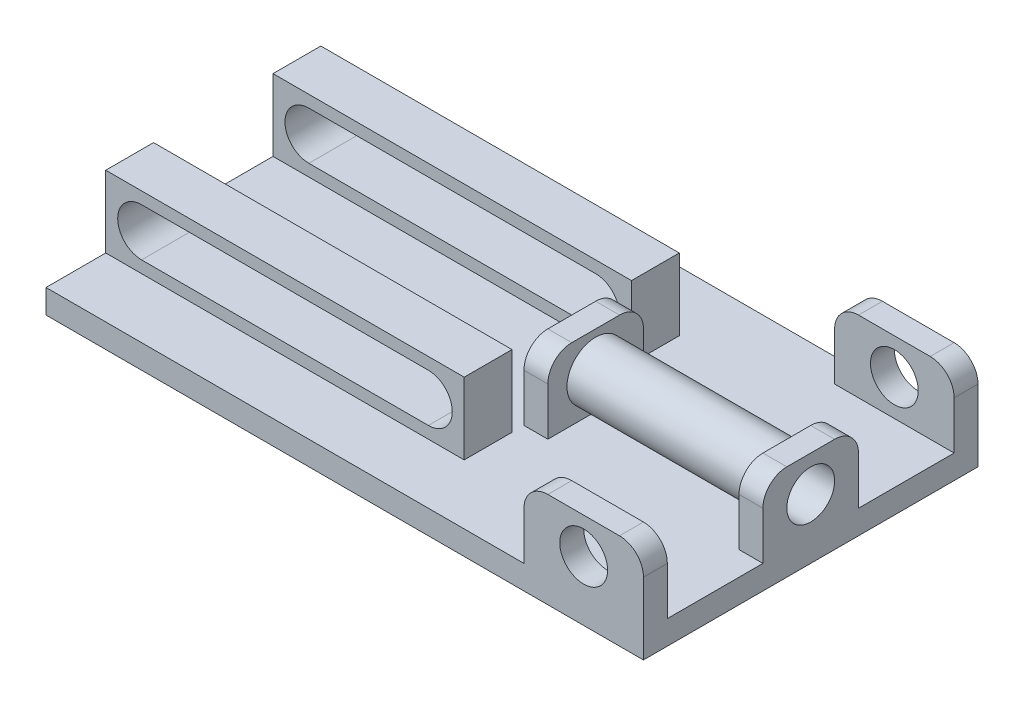
from build123d import *

# Parameters (mm, degrees)
SKETCH1_W           = 250
SKETCH1_H           = 140
BOSS_EXTRUDE1_DEPTH = 10
SKETCH2_W           = 150
SKETCH2_H           = 20
SKETCH2_W_2         = 50
BOSS_EXTRUDE2_DEPTH = 30
CUT_EXTRUDE1_DEPTH  = 120
SKETCH4_R           = 10
CUT_EXTRUDE2_DEPTH  = 150
SKETCH6_W           = 10
SKETCH6_H           = 40
CUT_EXTRUDE4_DEPTH  = 150
SKETCH7_R           = 10
CUT_EXTRUDE5_DEPTH  = 150
SKETCH8_R           = 12
SKETCH8_R_2         = 10
BOSS_EXTRUDE3_DEPTH = 80
SKETCH9_W           = 40
SKETCH9_H           = 30
SKETCH9_R           = 10
BOSS_EXTRUDE4_DEPTH = 10
FILLET1_R           = 10
FILLET2_R           = 10
FILLET3_R           = 10
SKETCH13_W          = 50
SKETCH13_H          = 25
SKETCH13_H_2        = 22.244291656
CUT_EXTRUDE6_DEPTH  = 40


with BuildPart() as part:
    # Sketch1 → Boss-Extrude1 (new body)
    with BuildSketch(Plane(origin=(0, 0, 0), x_dir=(1, 0, 0), z_dir=(0, 1, 0))):
        Rectangle(SKETCH1_W, SKETCH1_H)
    extrude(amount=BOSS_EXTRUDE1_DEPTH)

    # Sketch2 → Boss-Extrude2 (add)
    with BuildSketch(Plane(origin=(0, 10, 0), x_dir=(1, 0, 0), z_dir=(0, 1, 0))):
        with Locations((-50, 35)):
            Rectangle(SKETCH2_W, SKETCH2_H)
        with Locations((-50, -35)):
            Rectangle(SKETCH2_W, SKETCH2_H)
        Polygon((125, -20), (125, 0), (125, 20), (105, 20), (105, -20), align=None)
        with Locations((100, 60)):
            Rectangle(SKETCH2_W_2, SKETCH2_H)
        with Locations((100, -60)):
            Rectangle(SKETCH2_W_2, SKETCH2_H)
    extrude(amount=BOSS_EXTRUDE2_DEPTH)

    # Sketch3 → Cut-Extrude1 (cut)
    with BuildSketch(Plane.XY.offset(45)):
        with BuildLine():
            Line((10, 35), (-110, 35))
            ThreePointArc((-110, 35), (-120, 25), (-110, 15))
            Line((-110, 15), (10, 15))
            ThreePointArc((10, 15), (20, 25), (10, 35))
        make_face()
    extrude(amount=-CUT_EXTRUDE1_DEPTH, mode=Mode.SUBTRACT)

    # Sketch4 → Cut-Extrude2 (cut)
    with BuildSketch(Plane.XY.offset(70)):
        with Locations((100, 25)):
            Circle(SKETCH4_R)
    extrude(amount=-CUT_EXTRUDE2_DEPTH, mode=Mode.SUBTRACT)

    # Sketch6 → Cut-Extrude4 (cut)
    with BuildSketch(Plane(origin=(0, 10, 0), x_dir=(1, 0, 0), z_dir=(0, 1, 0))):
        with Locations((110, 0)):
            Rectangle(SKETCH6_W, SKETCH6_H)
    extrude(amount=CUT_EXTRUDE4_DEPTH, mode=Mode.SUBTRACT)

    # Sketch7 → Cut-Extrude5 (cut)
    with BuildSketch(Plane(origin=(125, 0, 0), x_dir=(0, 0, -1), z_dir=(1, 0, 0))):
        with Locations((0, 25)):
            Circle(SKETCH7_R)
    extrude(amount=-CUT_EXTRUDE5_DEPTH, mode=Mode.SUBTRACT)

    # Sketch8 → Boss-Extrude3 (add)
    with BuildSketch(Plane.ZY.offset(-115)):
        with Locations((0, 25)):
            Circle(SKETCH8_R)
        with Locations(Location((0, 25, 0), (0, 0, 180))):
            Circle(SKETCH8_R_2, mode=Mode.SUBTRACT)
    extrude(amount=BOSS_EXTRUDE3_DEPTH)

    # Sketch9 → Boss-Extrude4 (add)
    with BuildSketch(Plane.ZY.offset(-35)):
        with Locations((0, 25)):
            Rectangle(SKETCH9_W, SKETCH9_H)
        with Locations(Location((0, 25, 0), (0, 0, 180))):
            Circle(SKETCH9_R, mode=Mode.SUBTRACT)
    extrude(amount=BOSS_EXTRUDE4_DEPTH)

    # Fillet1
    fillet1_edges = [part.edges().sort_by_distance(p)[0] for p in [
        (30, 40, 20),
        (30, 40, -20),
    ]]
    fillet(fillet1_edges, radius=FILLET1_R)

    # Fillet2
    fillet2_edges = [part.edges().sort_by_distance(p)[0] for p in [
        (120, 40, 20),
        (120, 40, -20),
    ]]
    fillet(fillet2_edges, radius=FILLET2_R)

    # Fillet3
    fillet3_edges = [part.edges().sort_by_distance(p)[0] for p in [
        (75, 40, -60),
        (125, 40, -60),
        (75, 40, 60),
        (125, 40, 60),
    ]]
    fillet(fillet3_edges, radius=FILLET3_R)

    # Sketch13 → Cut-Extrude6 (cut)
    with BuildSketch(Plane(origin=(0, 10, 0), x_dir=(1, 0, 0), z_dir=(0, 1, 0))):
        with Locations((100, 47.5)):
            Rectangle(SKETCH13_W, SKETCH13_H)
        with Locations((100, -48.877854172)):
            Rectangle(SKETCH13_W, SKETCH13_H_2)
    extrude(amount=CUT_EXTRUDE6_DEPTH, mode=Mode.SUBTRACT)


solid = part.part
